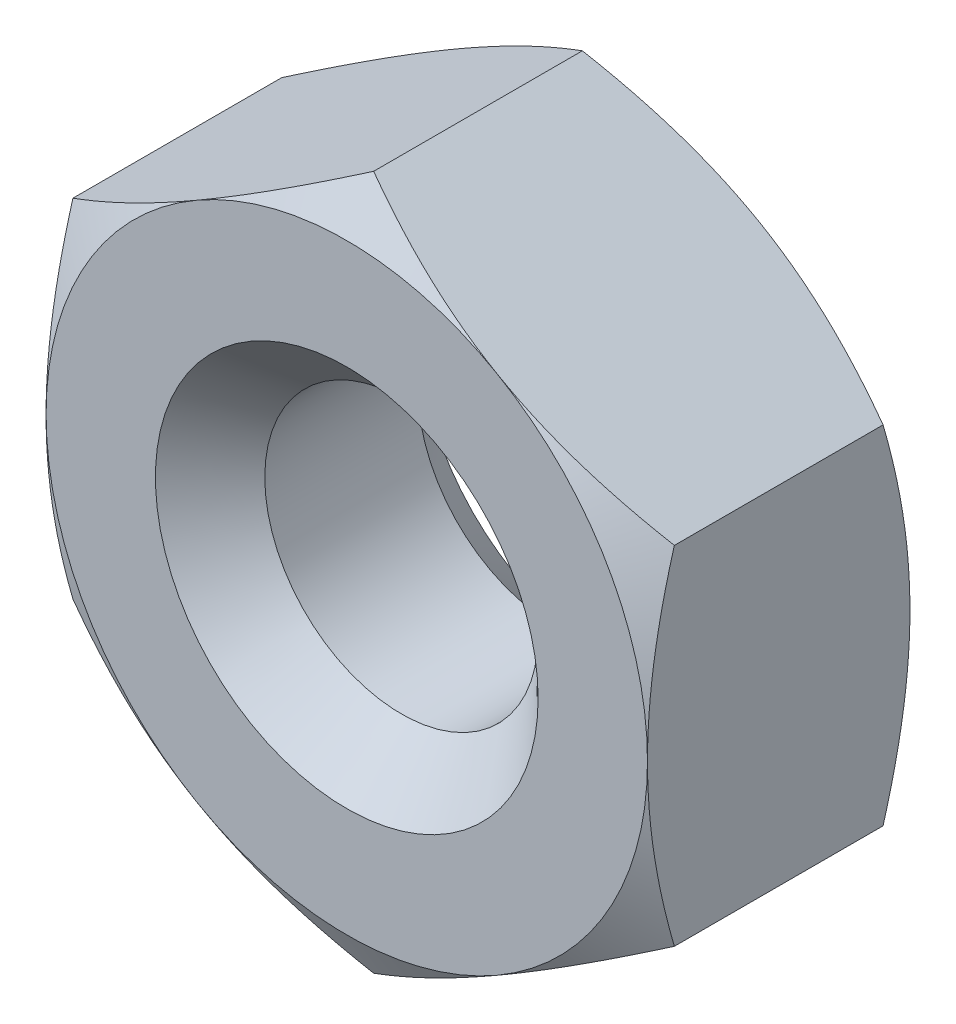
from build123d import *

# Parameters (mm, degrees)
EXTRUDE_1_DEPTH   = 2.4
HOLE_WIZARD_M31_D = 2.5
CHAMFER_1_SIZE    = 0.5


with BuildPart() as part:
    # Эскиз1 → Бобышка-Вытянуть1 (new body)
    with BuildSketch(Plane.XY):
        Polygon((2.75, 1.58771324), (0, 3.175426481), (-2.75, 1.58771324), (-2.75, -1.58771324), (0, -3.175426481), (2.75, -1.58771324), align=None)
    extrude(amount=EXTRUDE_1_DEPTH)

    # Отверстие обработанное метчиком M31 (through all)
    with Locations(Plane.XY.offset(2.4)):
        with Locations((0, 0)):
            Hole(HOLE_WIZARD_M31_D / 2)

    # Фаска1
    chamfer_1_edges = [part.edges().sort_by_distance(p)[0] for p in [
        (1.25, 0, 2.4),
        (1.25, 0, 0),
    ]]
    chamfer(chamfer_1_edges, length=CHAMFER_1_SIZE)

    # Эскиз4 → Вырез-Повернуть1 (revolve, cut)
    with BuildSketch(Plane(origin=(0, 0, 0), x_dir=(0, 0, -1), z_dir=(1, 0, 0)), mode=Mode.PRIVATE) as cut_revolve_1_sk:
        Polygon((0, 2.75), (0, 4), (-0.721687836, 4), align=None)
        Polygon((-2.4, 2.75), (-2.4, 4), (-1.678312164, 4), align=None)
    revolve(cut_revolve_1_sk.sketch.rotate(Axis((0, 0, 0), (0, 0, 1)), 270), axis=Axis((0, 0, 0), (0, 0, 1)), mode=Mode.SUBTRACT)


solid = part.part
